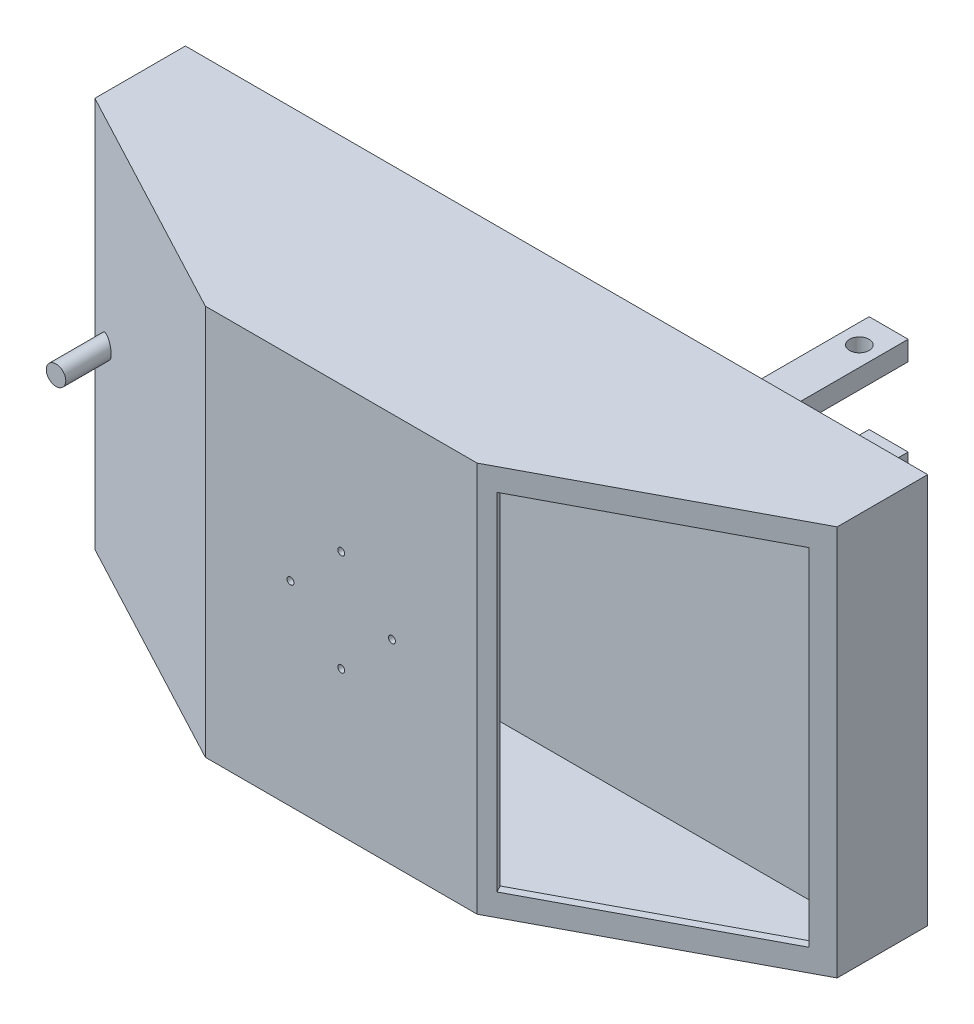
from build123d import *

# Parameters (mm, degrees)
SKETCH1_W                = 965.2
SKETCH1_H                = 508
BOSS_EXTRUDE1_DEPTH      = 50.8
SKETCH3_W                = 50.8
SKETCH3_H                = 25.4
BOSS_EXTRUDE2_DEPTH      = 177.8
CUT_EXTRUDE2_DEPTH       = 592.334693723
CUT_EXTRUDE2_DEPTH_BACK  = 592.334693723
SKETCH4_R                = 12.7
BOSS_EXTRUDE3_DEPTH      = 254
BOSS_EXTRUDE3_DEPTH_BACK = 254
BOSS_EXTRUDE4_DEPTH      = 12.7
BOSS_EXTRUDE5_START      = -508
BOSS_EXTRUDE5_DEPTH      = 12.7
CUT_EXTRUDE3_DEPTH       = 592.556393084
CUT_EXTRUDE3_DEPTH_BACK  = 592.556393084
SKETCH2_R                = 12.7
CUT_EXTRUDE4_START       = -50.8
SKETCH12_R               = 25.4
SKETCH12_R_2             = 12.7
CUT_EXTRUDE4_DEPTH       = 12.7
SKETCH13_R               = 12.7
CUT_EXTRUDE5_DEPTH       = 25.4
CUT_EXTRUDE6_START       = -2.7
SKETCH14_R               = 25.4
SKETCH14_R_2             = 12.7
CUT_EXTRUDE6_DEPTH       = 12.7
CUT_EXTRUDE7_DEPTH       = 10
CUT_EXTRUDE7_DEPTH_BACK  = 592.556393084
SKETCH15_R               = 12.7
SKETCH2_4_R              = 12.7
BOSS_EXTRUDE6_DEPTH      = 150
CUT_EXTRUDE8_REACH       = 714.022
SKETCH16_R               = 4.5
CUT_EXTRUDE9_REACH       = 823.718
SKETCH17_W               = 300
SKETCH17_H               = 450


with BuildPart() as part:
    # Sketch1 → Boss-Extrude1 (new body)
    with BuildSketch(Plane.XY):
        Rectangle(SKETCH1_W, SKETCH1_H)
    extrude(amount=-BOSS_EXTRUDE1_DEPTH)

    # Sketch3 → Boss-Extrude2 (add)
    with BuildSketch(Plane(origin=(0, 0, -50.8), x_dir=(-1, 0, 0), z_dir=(0, 0, -1))):
        with Locations((-254, 203.2)):
            Rectangle(SKETCH3_W, SKETCH3_H)
        with Locations((-254, 76.2)):
            Rectangle(SKETCH3_W, SKETCH3_H)
        with Locations((-254, -76.2)):
            Rectangle(SKETCH3_W, SKETCH3_H)
        with Locations((-254, -203.2)):
            Rectangle(SKETCH3_W, SKETCH3_H)
    extrude(amount=BOSS_EXTRUDE2_DEPTH)

    # Sketch4 → Cut-Extrude2 (cut, two sides: drawn at the far end of the back side and taken through both)
    with BuildSketch(Plane(origin=(0, 0, 0), x_dir=(1, 0, 0), z_dir=(0, 1, 0)).offset(-CUT_EXTRUDE2_DEPTH_BACK)):
        with Locations(Location((254, 190.5, 0), (0, 0, 270))):
            Circle(SKETCH4_R)
    extrude(amount=CUT_EXTRUDE2_DEPTH + CUT_EXTRUDE2_DEPTH_BACK, mode=Mode.SUBTRACT)

    # Sketch10 → Boss-Extrude3 (add, two sides: drawn at the far end of the back side and taken through both)
    with BuildSketch(Plane(origin=(0, 0, 0), x_dir=(1, 0, 0), z_dir=(0, 1, 0)).offset(-BOSS_EXTRUDE3_DEPTH_BACK)):
        Polygon((482.6, 0), (-482.6, 0), (-482.6, -66.924314291), (-176.649889789, -229.172874046), (0, -229.172874046), (176.649889789, -229.172874046), (482.6, -66.924314291), align=None)
        Polygon((-472.6, -60.908279697), (-472.6, -10), (472.6, -10), (472.6, -60.908279697), (174.162404273, -219.172874046), (0, -219.172874046), (-174.162404273, -219.172874046), align=None, mode=Mode.SUBTRACT)
    extrude(amount=BOSS_EXTRUDE3_DEPTH + BOSS_EXTRUDE3_DEPTH_BACK)

    # Sketch11 → Boss-Extrude4 (add)
    with BuildSketch(Plane.XZ.offset(254)):
        Polygon((-472.6, 10), (-472.6, 60.908279697), (-174.162404273, 219.172874046), (174.162404273, 219.172874046), (472.6, 60.908279697), (472.6, 10), align=None)
    extrude(amount=-BOSS_EXTRUDE4_DEPTH)

    # Sketch11<2> → Boss-Extrude5 (add)
    with BuildSketch(Plane.XZ.offset(254).offset(BOSS_EXTRUDE5_START)):
        Polygon((-472.6, 10), (-472.6, 60.908279697), (-174.162404273, 219.172874046), (174.162404273, 219.172874046), (472.6, 60.908279697), (472.6, 10), align=None)
    extrude(amount=BOSS_EXTRUDE5_DEPTH)

    # Sketch2 → Cut-Extrude3 (cut, two sides: drawn at the far end of the back side and taken through both)
    with BuildSketch(Plane.XY.offset(-CUT_EXTRUDE3_DEPTH_BACK)):
        with Locations((-450, 0)):
            Circle(SKETCH2_R)
    extrude(amount=CUT_EXTRUDE3_DEPTH + CUT_EXTRUDE3_DEPTH_BACK, mode=Mode.SUBTRACT)

    # Sketch12 → Cut-Extrude4 (cut)
    # profile 1 of 2: a face of its own
    with BuildSketch(Plane.XY.offset(CUT_EXTRUDE4_START)):
        with Locations(Location((-254, 139.7, 0), (0, 0, 180))):
            Circle(SKETCH12_R)
        with Locations(Location((-254, 139.7, 0), (0, 0, 180))):
            Circle(SKETCH12_R_2, mode=Mode.SUBTRACT)
    # profile 2 of 2: a face of its own
    with BuildSketch(Plane.XY.offset(CUT_EXTRUDE4_START)):
        with Locations(Location((-254, -139.7, 0), (0, 0, 180))):
            Circle(SKETCH12_R)
        with Locations(Location((-254, -139.7, 0), (0, 0, 180))):
            Circle(SKETCH12_R_2, mode=Mode.SUBTRACT)
    extrude(amount=CUT_EXTRUDE4_DEPTH, mode=Mode.SUBTRACT)

    # Sketch13 → Cut-Extrude5 (cut)
    with BuildSketch(Plane(origin=(0, 0, -50.8), x_dir=(-1, 0, 0), z_dir=(0, 0, -1))):
        with Locations((254, 139.7)):
            Circle(SKETCH13_R)
        with Locations((254, -139.7)):
            Circle(SKETCH13_R)
    extrude(amount=-CUT_EXTRUDE5_DEPTH, mode=Mode.SUBTRACT)

    # Sketch14 → Cut-Extrude6 (cut)
    # profile 1 of 2: a face of its own
    with BuildSketch(Plane.XY.offset(CUT_EXTRUDE6_START)):
        with Locations(Location((-254, 139.7, 0), (0, 0, 180))):
            Circle(SKETCH14_R)
        with Locations(Location((-254, 139.7, 0), (0, 0, 180))):
            Circle(SKETCH14_R_2, mode=Mode.SUBTRACT)
    # profile 2 of 2: a face of its own
    with BuildSketch(Plane.XY.offset(CUT_EXTRUDE6_START)):
        with Locations(Location((-254, -139.7, 0), (0, 0, 180))):
            Circle(SKETCH14_R)
        with Locations(Location((-254, -139.7, 0), (0, 0, 180))):
            Circle(SKETCH14_R_2, mode=Mode.SUBTRACT)
    extrude(amount=CUT_EXTRUDE6_DEPTH, mode=Mode.SUBTRACT)

    # Sketch15 → Cut-Extrude7 (cut, two sides: drawn at the far end of the back side and taken through both)
    with BuildSketch(Plane.XY.offset(-CUT_EXTRUDE7_DEPTH_BACK)):
        with Locations(Location((-254, -139.7, 0), (0, 0, 180))):
            Circle(SKETCH15_R)
        with Locations(Location((-254, 139.7, 0), (0, 0, 180))):
            Circle(SKETCH15_R)
    extrude(amount=CUT_EXTRUDE7_DEPTH + CUT_EXTRUDE7_DEPTH_BACK, mode=Mode.SUBTRACT)

    # Sketch2<4> → Boss-Extrude6 (add)
    with BuildSketch(Plane.XY):
        with Locations((-450, 0)):
            Circle(SKETCH2_4_R)
    extrude(amount=BOSS_EXTRUDE6_DEPTH)

    # Sketch16 → Cut-Extrude8 (cut, up to next)
    with BuildSketch(Plane.XY.offset(229.172874046), mode=Mode.PRIVATE) as cut_extrude8_sk1:
        with Locations((-66, 0)):
            Circle(SKETCH16_R)
    cut_extrude8_tool1 = extrude(cut_extrude8_sk1.sketch, amount=-CUT_EXTRUDE8_REACH, mode=Mode.PRIVATE) & part.part
    # Sketch16 → Cut-Extrude8 (cut, up to next)
    with BuildSketch(Plane.XY.offset(229.172874046), mode=Mode.PRIVATE) as cut_extrude8_sk2:
        with Locations((0, 66)):
            Circle(SKETCH16_R)
    cut_extrude8_tool2 = extrude(cut_extrude8_sk2.sketch, amount=-CUT_EXTRUDE8_REACH, mode=Mode.PRIVATE) & part.part
    # Sketch16 → Cut-Extrude8 (cut, up to next)
    with BuildSketch(Plane.XY.offset(229.172874046), mode=Mode.PRIVATE) as cut_extrude8_sk3:
        with Locations((66, 0)):
            Circle(SKETCH16_R)
    cut_extrude8_tool3 = extrude(cut_extrude8_sk3.sketch, amount=-CUT_EXTRUDE8_REACH, mode=Mode.PRIVATE) & part.part
    # Sketch16 → Cut-Extrude8 (cut, up to next)
    with BuildSketch(Plane.XY.offset(229.172874046), mode=Mode.PRIVATE) as cut_extrude8_sk4:
        with Locations((0, -66)):
            Circle(SKETCH16_R)
    cut_extrude8_tool4 = extrude(cut_extrude8_sk4.sketch, amount=-CUT_EXTRUDE8_REACH, mode=Mode.PRIVATE) & part.part
    add(cut_extrude8_tool1.solids().sort_by_distance((-66, 0, 229.172874))[0], mode=Mode.SUBTRACT)
    add(cut_extrude8_tool2.solids().sort_by_distance((0, 66, 229.172874))[0], mode=Mode.SUBTRACT)
    add(cut_extrude8_tool3.solids().sort_by_distance((66, 0, 229.172874))[0], mode=Mode.SUBTRACT)
    add(cut_extrude8_tool4.solids().sort_by_distance((0, -66, 229.172874))[0], mode=Mode.SUBTRACT)

    # Sketch17 → Cut-Extrude9 (cut, up to next)
    with BuildSketch(Plane(origin=(133.630964067, 0, 251.986262594), x_dir=(0.8834593660439969, 0, -0.4685077892086097), z_dir=(0.4685077892086097, 0, 0.8834593660439969)), mode=Mode.PRIVATE) as cut_extrude9_sk1:
        with Locations((217.872449791, 0)):
            Rectangle(SKETCH17_W, SKETCH17_H)
    cut_extrude9_tool1 = extrude(cut_extrude9_sk1.sketch, amount=-CUT_EXTRUDE9_REACH, mode=Mode.PRIVATE) & part.part
    add(cut_extrude9_tool1.solids().sort_by_distance((326.11242, 0, 149.911323))[0], mode=Mode.SUBTRACT)


solid = part.part
